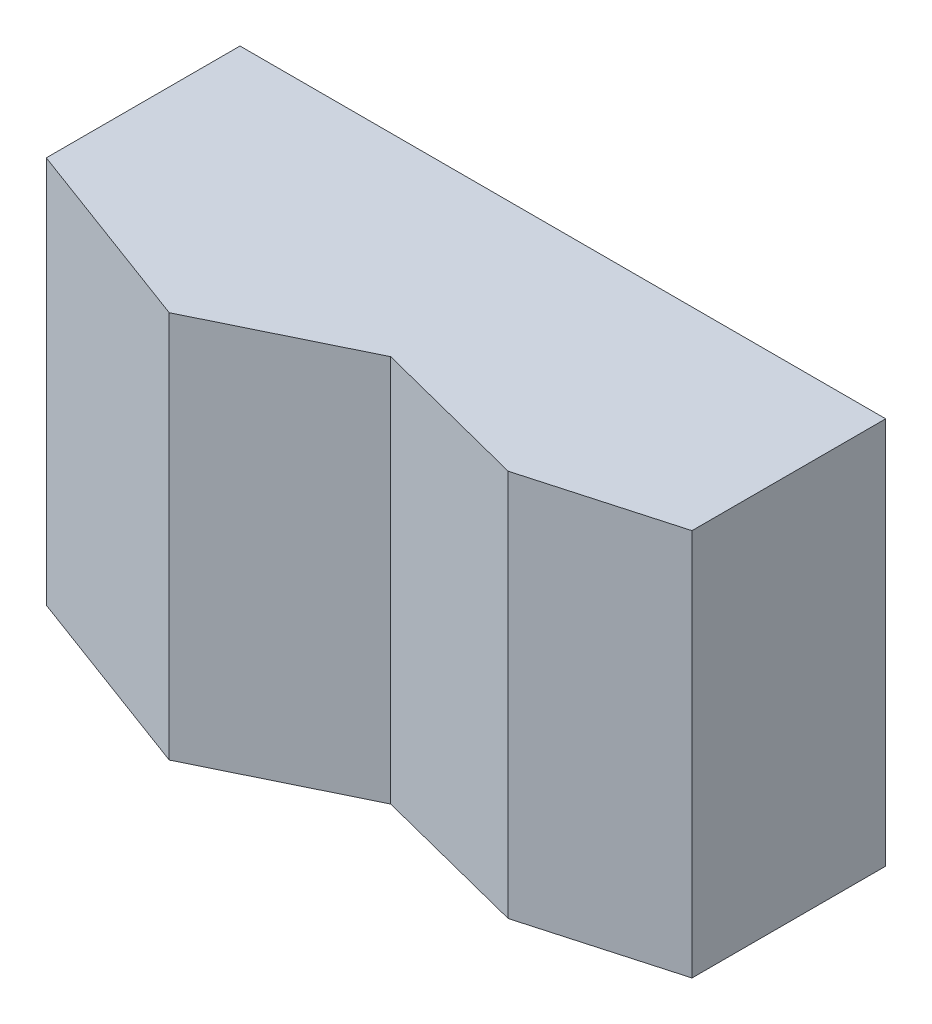
from build123d import *

# Parameters (mm, degrees)
SKETCH1_W           = 10
SKETCH1_H           = 6
BOSS_EXTRUDE1_DEPTH = 3
BOSS_EXTRUDE2_DEPTH = 6
SKETCH3_W           = 0.5
SKETCH3_H           = 2
SKETCH3_W_2         = 1
SKETCH3_H_2         = 3
CUT_EXTRUDE1_DEPTH  = 1.5


with BuildPart() as part:
    # Sketch1 → Boss-Extrude1 (new body)
    with BuildSketch(Plane.XY):
        with Locations((5, 3)):
            Rectangle(SKETCH1_W, SKETCH1_H)
    extrude(amount=BOSS_EXTRUDE1_DEPTH)

    # Sketch2 → Boss-Extrude2 (add)
    with BuildSketch(Plane.XZ):
        Polygon((3.028685262, 4.124905721), (0, 3), (5.333823351, 3), align=None)
        Polygon((7.779518642, 3.625927659), (5.333823351, 3), (10, 3), align=None)
    extrude(amount=-BOSS_EXTRUDE2_DEPTH)

    # Sketch3 → Cut-Extrude1 (cut)
    with BuildSketch(Plane(origin=(0, 0, 0), x_dir=(-1, 0, 0), z_dir=(0, 0, -1))):
        with Locations((-2.75, 3.5)):
            Rectangle(SKETCH3_W, SKETCH3_H)
        with Locations((-6.5, 3)):
            Rectangle(SKETCH3_W_2, SKETCH3_H_2)
    extrude(amount=-CUT_EXTRUDE1_DEPTH, mode=Mode.SUBTRACT)


solid = part.part
